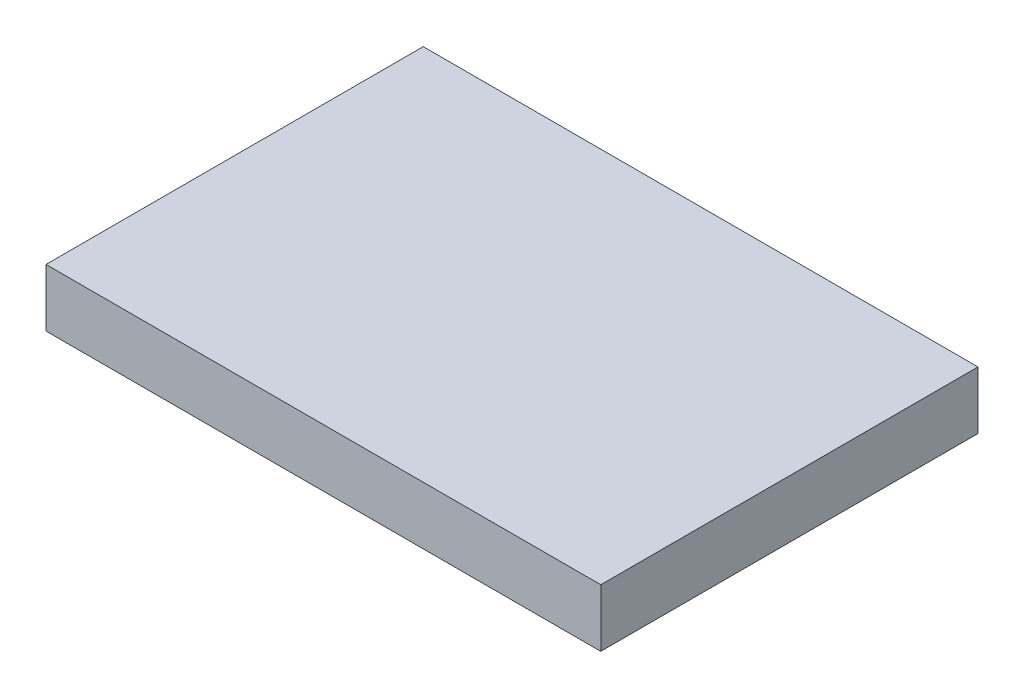
from build123d import *

# Parameters (mm, degrees)
SKETCH1_W           = 50
SKETCH1_H           = 34
BOSS_EXTRUDE1_DEPTH = 5.2


with BuildPart() as part:
    # Sketch1 → Boss-Extrude1 (new body)
    with BuildSketch(Plane(origin=(0, 0, 0), x_dir=(1, 0, 0), z_dir=(0, 1, 0))):
        Rectangle(SKETCH1_W, SKETCH1_H)
    extrude(amount=BOSS_EXTRUDE1_DEPTH)


solid = part.part
